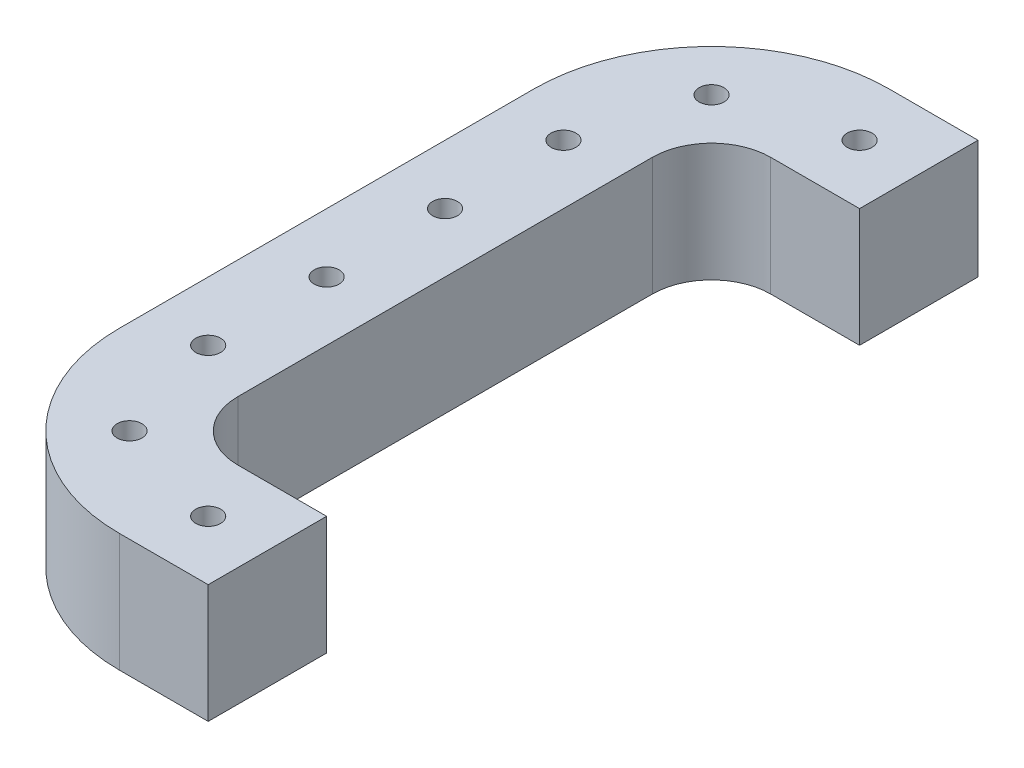
from build123d import *

# Parameters (mm, degrees)
BOSS_EXTRUDE1_DEPTH = 10
SKETCH3_W           = 20
SKETCH3_H           = 20
BOSS_EXTRUDE2_DEPTH = 20
SKETCH2_R           = 2.1
CUT_EXTRUDE1_DEPTH  = 61.415229868


with BuildPart() as part:
    # Sketch1 → Boss-Extrude1 (new, symmetric)
    with BuildSketch(Plane(origin=(0, 0, 0), x_dir=(1, 0, 0), z_dir=(0, 1, 0))):
        with BuildLine():
            Line((10, 0), (10, 15))
            ThreePointArc((10, 15), (12.928932188, 22.071067812), (20, 25))
            Line((20, 25), (35, 25))
            Line((35, 25), (35, 45))
            Line((35, 45), (20, 45))
            ThreePointArc((20, 45), (-1.213203436, 36.213203436), (-10, 15))
            Line((-10, 15), (-10, 0))
            Line((-10, 0), (10, 0))
        make_face()
    extrude(amount=BOSS_EXTRUDE1_DEPTH, both=True)

    # Sketch3 → Boss-Extrude2 (add)
    with BuildSketch(Plane(origin=(0, 10, 0), x_dir=(1, 0, 0), z_dir=(0, 1, 0))):
        with Locations((0, -10)):
            Rectangle(SKETCH3_W, SKETCH3_H)
    extrude(amount=-BOSS_EXTRUDE2_DEPTH)

    # Sketch2 → Cut-Extrude1 (cut, through all)
    with BuildSketch(Plane(origin=(0, 10, 0), x_dir=(1, 0, 0), z_dir=(0, 1, 0))):
        with Locations(Location((5.857864376, 29.142135624, 0), (0, 0, 270))):
            Circle(SKETCH2_R)
        with Locations(Location((0, 10, 0), (0, 0, 270))):
            Circle(SKETCH2_R)
        with Locations(Location((25, 35, 0), (0, 0, 90))):
            Circle(SKETCH2_R)
        with Locations(Location((0, -10, 0), (0, 0, 270))):
            Circle(SKETCH2_R)
    extrude(amount=-CUT_EXTRUDE1_DEPTH, mode=Mode.SUBTRACT)

    # Mirror1: part across plane


with BuildPart() as part_1:
    add(part.part)
    add(part.part.mirror(Plane(origin=(10, -38.284271247, 20), x_dir=(1, 0, 0), z_dir=(0, 0, 1))))


solid = part_1.part
